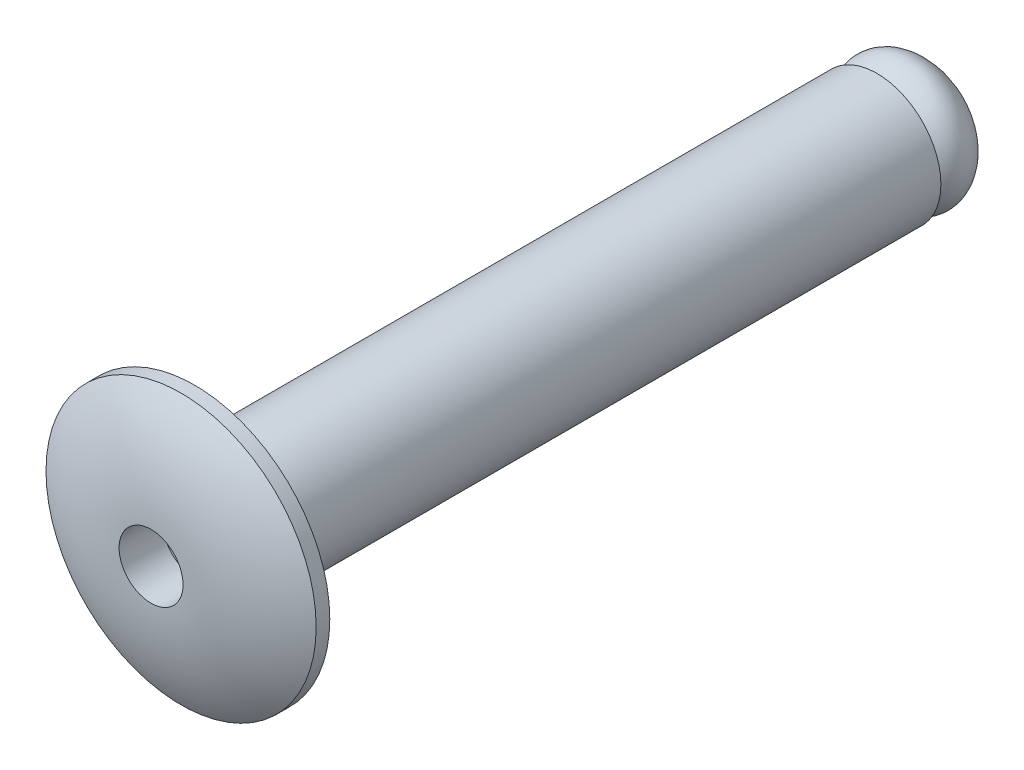
from build123d import *

# Parameters (mm, degrees)
CUT_EXTRUDE1_DEPTH      = 21.178633531
CUT_EXTRUDE1_DEPTH_BACK = 21.178633531
CUT_EXTRUDE2_DEPTH      = 21.178633531
CUT_EXTRUDE2_DEPTH_BACK = 21.178633531
FILLET2_R               = 0.254
SKETCH7_R               = 0.5953125
CUT_EXTRUDE3_DEPTH      = 21.178633531


with BuildPart() as part:
    # Sketch2 → Revolve1 (revolve)
    with BuildSketch(Plane(origin=(0, 0, 0), x_dir=(0, 0, -1), z_dir=(1, 0, 0)), mode=Mode.PRIVATE) as revolve1_sk:
        with BuildLine():
            Line((-19.8628, 0), (-19.8628, 0.5953125))
            Line((-19.8628, 0.5953125), (-0.8128, 0.5953125))
            ThreePointArc((-0.8128, 0.5953125), (-0.670258675, 1.594802613), (-0.254, 2.5146))
            Line((-0.254, 2.5146), (0, 2.5146))
            Line((0, 2.5146), (0, 1.190625))
            Line((0, 1.190625), (12.7, 1.190625))
            Line((12.7, 1.190625), (12.7, 0.89296875))
            add(Edge.make_bspline(
                [(13.9192, 0), (13.9192, 2.637532552), (12.7, 0.89296875)],
                knots=[4.71238898, 4.71238898, 4.71238898, 7.005919555, 7.005919555, 7.005919555], degree=2, weights=[1, 0.411437828, 1]))
            Line((13.9192, 0), (12.7, 0))
            Line((12.7, 0), (-19.8628, 0))
        make_face()
    revolve(revolve1_sk.sketch.rotate(Axis((0, 0, 19.8628), (0, 0, -1)), 90), axis=Axis((0, 0, 19.8628), (0, 0, -1)))

    # Sketch3 → Cut-Extrude1 (cut, two sides: drawn at the far end of the back side and taken through both)
    with BuildSketch(Plane(origin=(0, 0, 0), x_dir=(1, 0, 0), z_dir=(0, 1, 0)).offset(-CUT_EXTRUDE1_DEPTH_BACK)):
        Polygon((0, -19.8628), (0.7985125, -18.822158249), (0.7985125, -20.3708), (-0.7985125, -20.3708), (-0.7985125, -18.822158249), align=None)
    extrude(amount=CUT_EXTRUDE1_DEPTH + CUT_EXTRUDE1_DEPTH_BACK, mode=Mode.SUBTRACT)

    # Sketch4 → Cut-Extrude2 (cut, two sides: drawn at the far end of the back side and taken through both)
    with BuildSketch(Plane(origin=(0, 0, 0), x_dir=(0, 0, -1), z_dir=(1, 0, 0)).offset(-CUT_EXTRUDE2_DEPTH_BACK)):
        Polygon((-20.1168, 0), (-19.0134875, 1.1033125), (-20.3708, 1.1033125), (-20.3708, -1.1033125), (-19.0134875, -1.1033125), align=None)
    extrude(amount=CUT_EXTRUDE2_DEPTH + CUT_EXTRUDE2_DEPTH_BACK, mode=Mode.SUBTRACT)

    # Fillet2
    fillet2_edges = [part.edges().sort_by_distance(p)[0] for p in [
        (-1.190625, 0, 0),
    ]]
    fillet(fillet2_edges, radius=FILLET2_R)

    # Sketch7 → Cut-Extrude3 (cut, through all)
    with BuildSketch(Plane(origin=(0, 0, 0), x_dir=(-1, 0, 0), z_dir=(0, 0, -1))):
        Circle(SKETCH7_R)
    extrude(amount=-CUT_EXTRUDE3_DEPTH, mode=Mode.SUBTRACT)


solid = part.part
